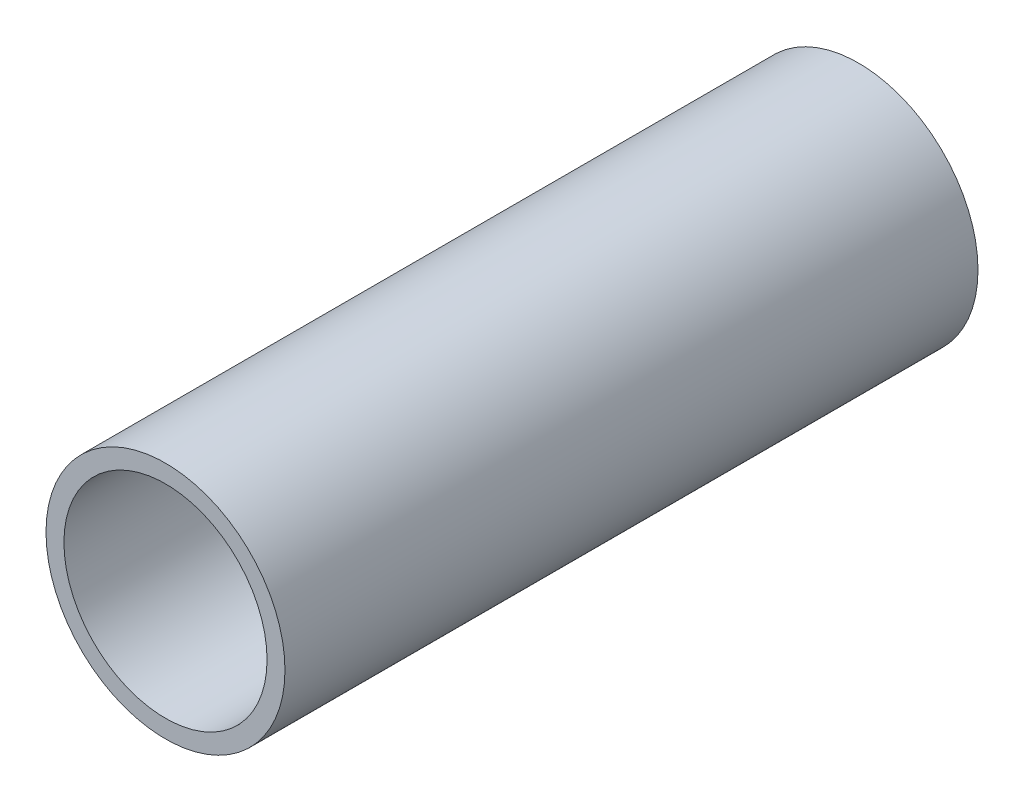
from build123d import *

# Parameters (mm, degrees)
SKETCH1_R           = 10
SKETCH1_R_2         = 8.5
BOSS_EXTRUDE1_DEPTH = 58


with BuildPart() as part:
    # Sketch1 → Boss-Extrude1 (new body)
    with BuildSketch(Plane.XY):
        with Locations(Location((0, 0, 0), (0, 0, 180))):
            Circle(SKETCH1_R)
        with Locations(Location((0, 0, 0), (0, 0, 180))):
            Circle(SKETCH1_R_2, mode=Mode.SUBTRACT)
    extrude(amount=BOSS_EXTRUDE1_DEPTH)


solid = part.part
